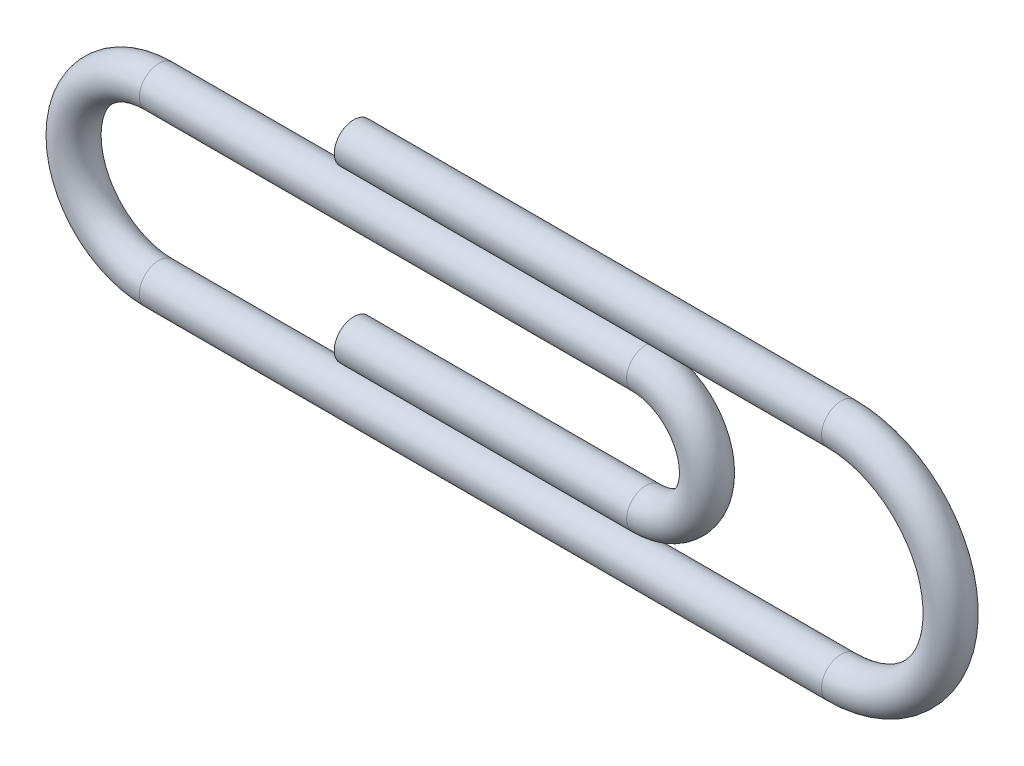
from build123d import *

# Parameters (mm, degrees)
SKETCH_3_R = 4


with BuildPart() as part:
    # По траектории2: sweep along a path in Эскиз2
    with BuildLine(Plane.XY) as sweep_2_path:
        Line((0, -12.5), (60, -12.5))
        ThreePointArc((60, -12.5), (72.5, 0), (60, 12.5))
        Line((60, 12.5), (-40, 12.5))
        ThreePointArc((-40, 12.5), (-57.5, -5), (-40, -22.5))
        Line((-40, -22.5), (100, -22.5))
        ThreePointArc((100, -22.5), (122.5, 0), (100, 22.5))
        Line((100, 22.5), (0, 22.5))
    # Эскиз3 → По траектории2 (sweep)
    with BuildSketch(Plane(origin=(0, 22.5, 0), x_dir=(0, 0, 1), z_dir=(-1, 0, 0))):
        Circle(SKETCH_3_R)
        Polygon((0, 2.886751346), (-2.5, 1.443375673), (-2.5, -1.443375673), (0, -2.886751346), (2.5, -1.443375673), (2.5, 1.443375673), align=None, mode=Mode.SUBTRACT)
    sweep(path=sweep_2_path.line)


solid = part.part
